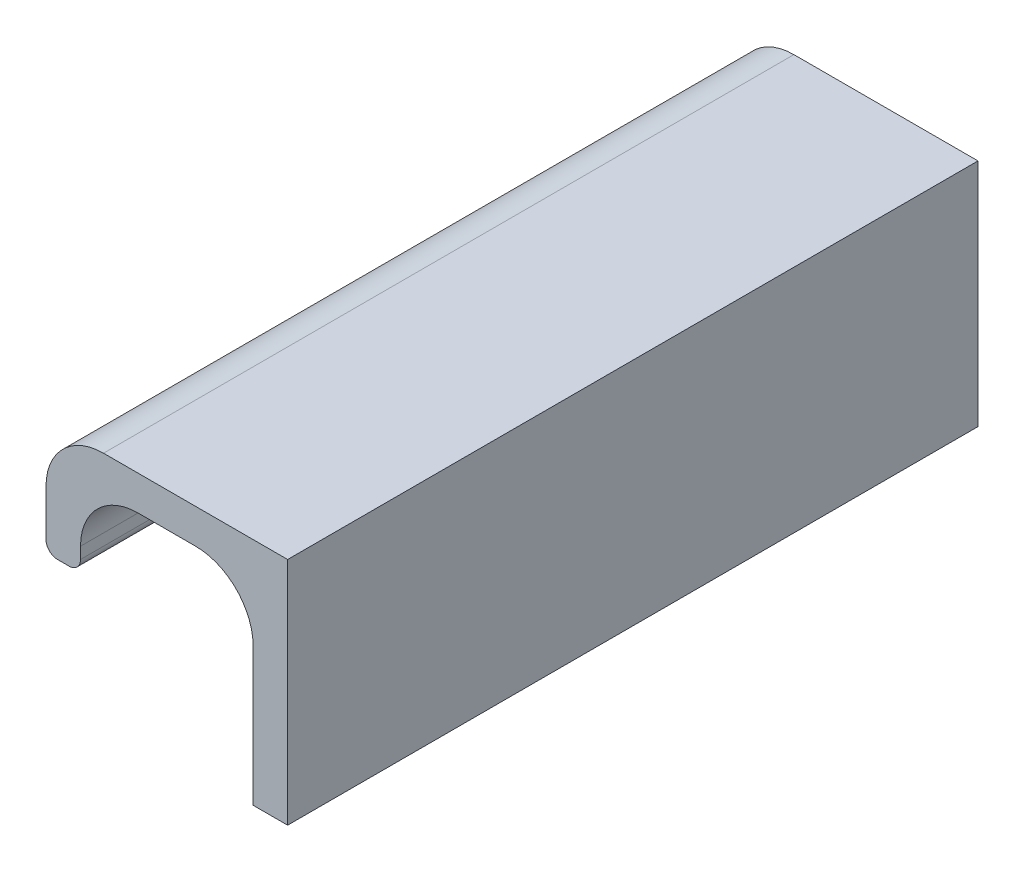
from build123d import *

# Parameters (mm, degrees)
BOSS_EXTRUDE1_DEPTH = 60


with BuildPart() as part:
    # Sketch1 → Boss-Extrude1 (new body)
    with BuildSketch(Plane.XY):
        with BuildLine():
            Line((0, 0), (0, -20))
            Line((0, -20), (-3, -20))
            Line((-3, -20), (-3, -8))
            ThreePointArc((-3, -8), (-4.464466094, -4.464466094), (-8, -3))
            Line((-8, -3), (-13, -3))
            ThreePointArc((-13, -3), (-16.535533906, -4.464466094), (-18, -8))
            Line((-18, -8), (-18, -9))
            ThreePointArc((-18, -9), (-18.292893219, -9.707106781), (-19, -10))
            Line((-19, -10), (-20, -10))
            ThreePointArc((-20, -10), (-20.707106781, -9.707106781), (-21, -9))
            Line((-21, -9), (-21, -5))
            ThreePointArc((-21, -5), (-19.535533906, -1.464466094), (-16, 0))
            Line((-16, 0), (0, 0))
        make_face()
    extrude(amount=BOSS_EXTRUDE1_DEPTH)


solid = part.part
